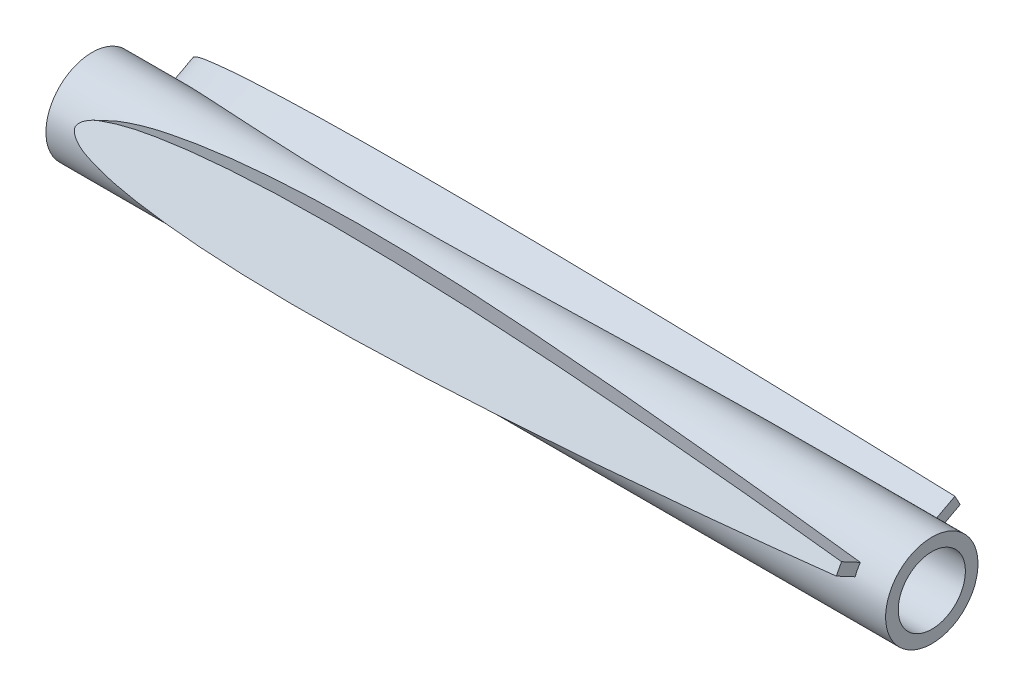
from build123d import *

# Parameters (mm, degrees)
EXTRUDE_1_DEPTH      = 190
EXTRUDE_1_DEPTH_BACK = 10
SKETCH_6_R           = 11
SKETCH_6_R_2         = 8
EXTRUDE_2_REACH      = 194.546
EXTRUDE_2_END_RADIUS = 11


with BuildPart() as part:
    # Эскиз6 → Бобышка-Вытянуть1 (new, two sides: drawn at the far end of the back side and taken through both)
    with BuildSketch(Plane(origin=(0, 0, 0), x_dir=(0, 0, -1), z_dir=(1, 0, 0)).offset(-EXTRUDE_1_DEPTH_BACK)):
        with Locations((-14.127161486, -7.511545005)):
            Circle(SKETCH_6_R)
        with Locations((-14.127161486, -7.511545005)):
            Circle(SKETCH_6_R_2, mode=Mode.SUBTRACT)
    extrude(amount=EXTRUDE_1_DEPTH + EXTRUDE_1_DEPTH_BACK)

    # Бобышка-Вытянуть2: up to this cylinder (the profile starts outside it)
    extrude_2_end = Plane(origin=(80.99793, -7.511545005, 14.127161486), z_dir=(1, 0, 0)) * Cylinder(EXTRUDE_2_END_RADIUS, 412.092, mode=Mode.PRIVATE)
    # Эскиз5 → Бобышка-Вытянуть2 (add, up to the surface)
    with BuildSketch(Plane(origin=(0, 0, 0), x_dir=(-1, 0, 0), z_dir=(0, -0.46947156278589147, 0.8829475928589267)), mode=Mode.PRIVATE) as extrude_2_sk1:
        with BuildLine():
            Line((-182, -1.331404921), (-182, 1.331404921))
            add(Edge.make_bspline(
                [(0, 0), (0, 0.935502638), (-2.27255633, 2.575925139), (-5.556771363, 3.642454712), (-9.737509568, 4.687162463), (-14.603656057, 5.487341662), (-21.113008927, 6.313420575), (-29.237058106, 7.005349565), (-38.995662394, 7.497703972), (-48.748351471, 7.755020887), (-61.750574897, 7.849257289), (-78.005067187, 7.610745658), (-97.505866771, 6.926671458), (-117.00605402, 5.970408057), (-136.50584792, 4.792830297), (-156.006422045, 3.439041438), (-171.170177646, 2.251181479), (-179.833667096, 1.518726568), (-182, 1.331404921)],
                knots=[0.5, 0.5, 0.5, 0.5, 0.508804888, 0.515439546, 0.528209398, 0.540779549, 0.553268654, 0.578140525, 0.602949076, 0.62773306, 0.652508673, 0.70206263, 0.751640903, 0.801249026, 0.850887776, 0.900556598, 0.950258285, 0.966833902, 0.966833902, 0.966833902, 0.966833902], degree=3))
            add(Edge.make_bspline(
                [(-182, -1.331404921), (-179.833667096, -1.518726568), (-171.170177646, -2.251181479), (-156.006422045, -3.439041438), (-136.50584792, -4.792830297), (-117.00605402, -5.970408057), (-97.505866771, -6.926671458), (-78.005067187, -7.610745658), (-61.750574897, -7.849257289), (-48.748351471, -7.755020887), (-38.995662394, -7.497703972), (-29.237058106, -7.005349565), (-21.113008927, -6.313420575), (-14.603656057, -5.487341662), (-9.737509568, -4.687162463), (-5.556771363, -3.642454712), (-2.27255633, -2.575925139), (0, -0.935502638), (0, 0)],
                knots=[0.033166098, 0.033166098, 0.033166098, 0.033166098, 0.049741715, 0.099443402, 0.149112224, 0.198750974, 0.248359097, 0.29793737, 0.347491327, 0.37226694, 0.397050924, 0.421859475, 0.446731346, 0.459220451, 0.471790602, 0.484560454, 0.491195112, 0.5, 0.5, 0.5, 0.5], degree=3))
        make_face()
    extrude_2_tool1 = extrude(extrude_2_sk1.sketch, amount=EXTRUDE_2_REACH, mode=Mode.PRIVATE) - extrude_2_end
    extrude_2 = extrude_2_tool1.solids().sort_by_distance((80.99793, 0, 0))[0]
    add(extrude_2)

    # Зеркальное отражение1: Бобышка-Вытянуть2 across plane
    add(extrude_2.mirror(Plane.XY.offset(14.127161486)))


solid = part.part
